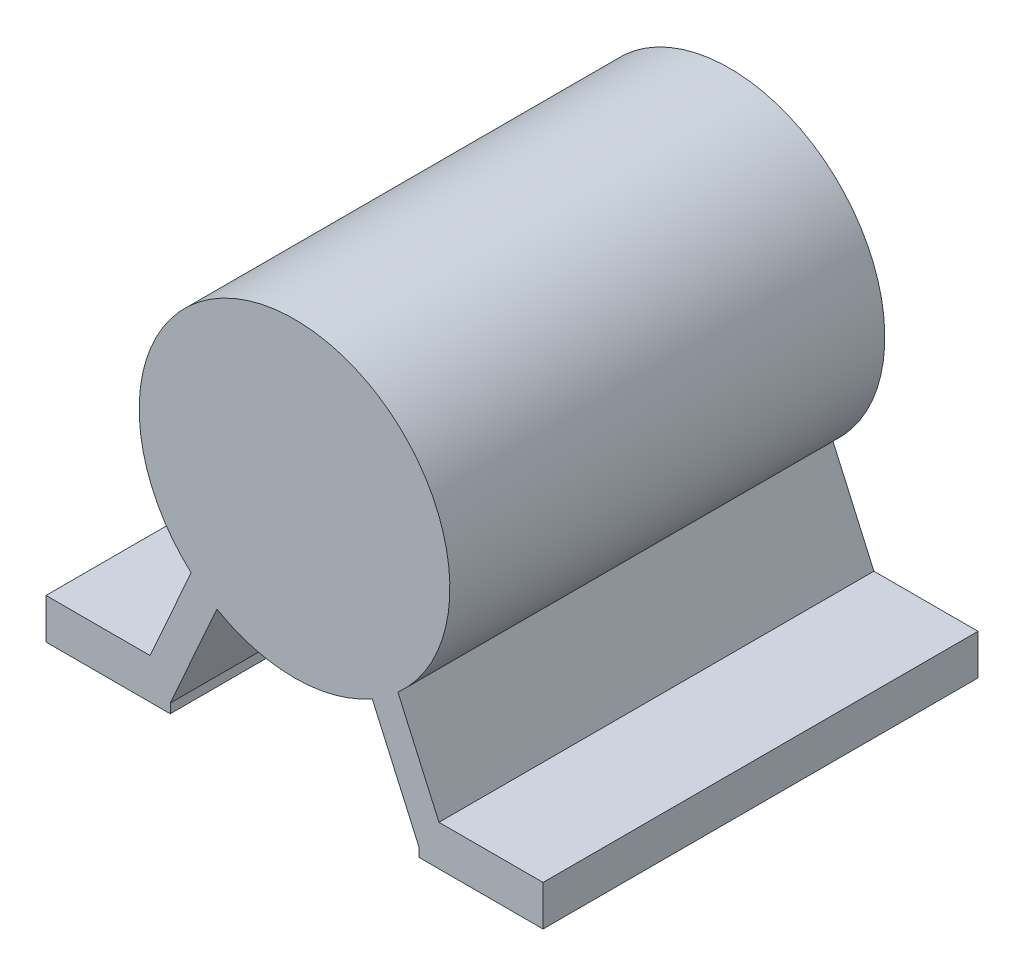
from build123d import *

# Parameters (mm, degrees)
EXTRUDE_1_DEPTH = 140


with BuildPart() as part:
    # ｽｹｯﾁ1 → ﾎﾞｽ - 押し出し1 (new body)
    with BuildSketch(Plane.XY):
        with BuildLine():
            Line((-40, -77), (-25, -43.301270189))
            ThreePointArc((-25, -43.301270189), (0, -50), (25, -43.301270189))
            Line((25, -43.301270189), (40, -77))
            Line((40, -77), (40, -80))
            Line((40, -80), (80, -80))
            Line((80, -80), (80, -67))
            Line((80, -67), (46.494717001, -67))
            Line((46.494717001, -67), (33.281076638, -37.314473571))
            ThreePointArc((33.281076638, -37.314473571), (0, 50), (-33.281076638, -37.314473571))
            Line((-33.281076638, -37.314473571), (-46.494717001, -67))
            Line((-46.494717001, -67), (-80, -67))
            Line((-80, -67), (-80, -80))
            Line((-80, -80), (-40, -80))
            Line((-40, -80), (-40, -77))
        make_face()
    extrude(amount=EXTRUDE_1_DEPTH)


solid = part.part
